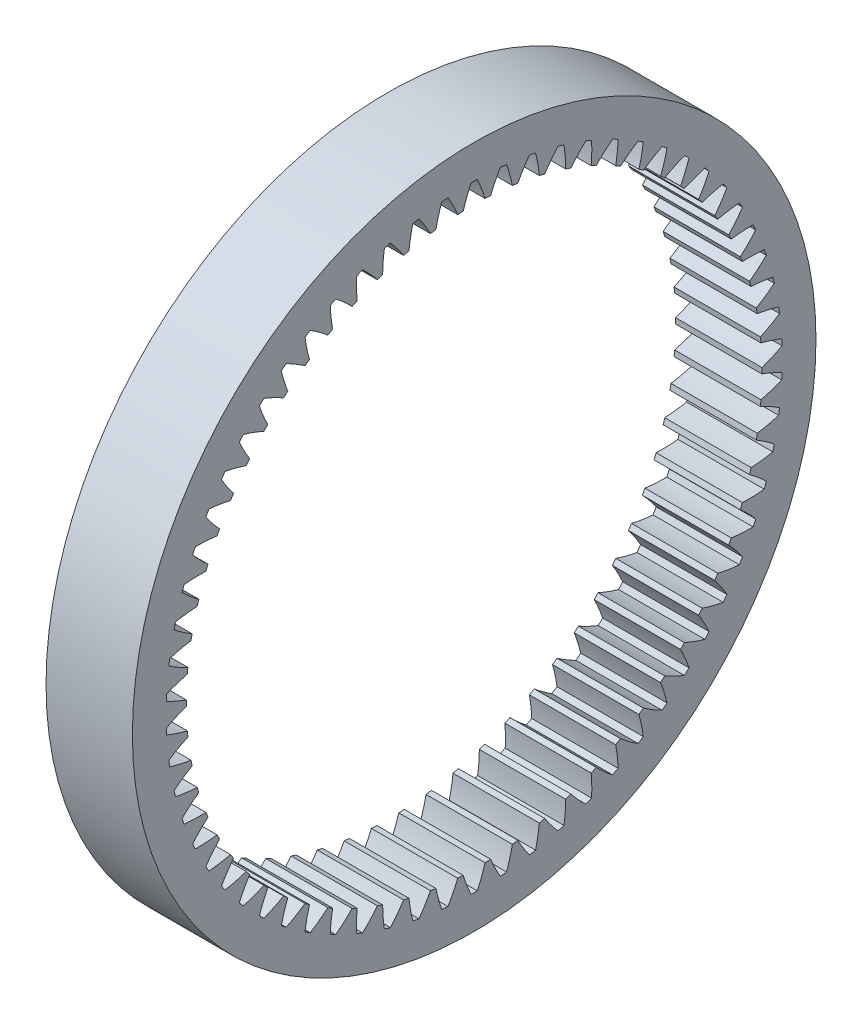
from build123d import *

# Parameters (mm, degrees)
BASPROSKE_W     = 12
BASPROSKE_H     = 7.5
TOOTHCUT_DEPTH  = 69.238552153
TEETHCUTS_COUNT = 66
TEETHCUTS_ANGLE = 354.545454545


with BuildPart() as part:
    # BasProSke → Base-Revolve (revolve)
    with BuildSketch(Plane(origin=(0, 0, 0), x_dir=(1, 0, 0), z_dir=(0, 1, 0)), mode=Mode.PRIVATE) as base_revolve_sk:
        with Locations((6, 43.75)):
            Rectangle(BASPROSKE_W, BASPROSKE_H)
    revolve(base_revolve_sk.sketch.rotate(Axis((-10, 0, 0), (1, 0, 0)), 180), axis=Axis((-10, 0, 0), (1, 0, 0)))

    # TooCutSke → ToothCut (cut, through all)
    with BuildSketch(Plane(origin=(0, 0, 0), x_dir=(0, 0, -1), z_dir=(1, 0, 0))):
        with BuildLine():
            ThreePointArc((1.525262564, 39.9454906), (1.032765309, 41.398715423), (0.433592163, 42.811304349))
            ThreePointArc((0.433592163, 42.811304349), (0, 42.8135), (-0.433592163, 42.811304349))
            ThreePointArc((-0.433592163, 42.811304349), (-1.032765309, 41.398715423), (-1.525262564, 39.9454906))
            ThreePointArc((-1.525262564, 39.9454906), (0, 39.9746), (1.525262564, 39.9454906))
        make_face()
    toothcut = extrude(amount=TOOTHCUT_DEPTH, mode=Mode.SUBTRACT)

    # TeethCuts: ToothCut ×66 about axis
    teethcuts_axis = Axis((-10, 0, 0), (1, 0, 0))
    for i in range(1, TEETHCUTS_COUNT):
        add(toothcut.rotate(teethcuts_axis, i * TEETHCUTS_ANGLE / (TEETHCUTS_COUNT - 1)), mode=Mode.SUBTRACT)


solid = part.part
